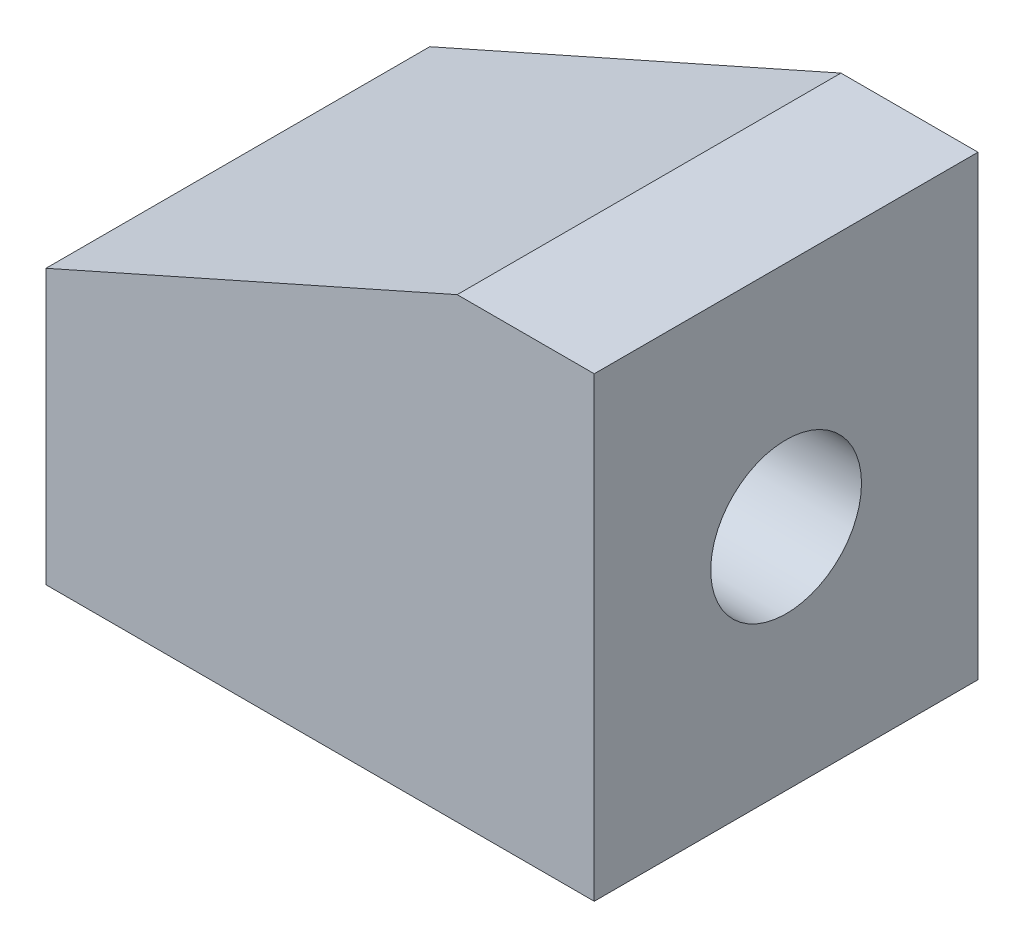
from build123d import *

# Parameters (mm, degrees)
ESTRUSIONE_ESTRUSIONE1_DEPTH   = 42
FORO_FILETTATO_M18X1_5_1_D     = 16.5
FORO_FILETTATO_M18X1_5_1_DEPTH = 43.5
FORO_FILETTATO_M18X1_5_1_TIP   = 4.957100107


with BuildPart() as part:
    # Schizzo1 → Estrusione-Estrusione1 (new body)
    with BuildSketch(Plane.XY):
        Polygon((-60, 0), (0, 0), (0, 50), (-15, 50), (-60, 30), align=None)
    extrude(amount=ESTRUSIONE_ESTRUSIONE1_DEPTH)

    # Foro filettato M18x1.5-1
    with Locations(Plane(origin=(0, 25, 21), x_dir=(0, 0, 1), z_dir=(1, 0, 0))):
        with Locations((0, 0)):
            Hole(FORO_FILETTATO_M18X1_5_1_D / 2, depth=FORO_FILETTATO_M18X1_5_1_DEPTH)
            with Locations((0, 0, -(FORO_FILETTATO_M18X1_5_1_DEPTH + FORO_FILETTATO_M18X1_5_1_TIP / 2))):  # 118° drill point
                Cone(0, FORO_FILETTATO_M18X1_5_1_D / 2, FORO_FILETTATO_M18X1_5_1_TIP, mode=Mode.SUBTRACT)


solid = part.part
